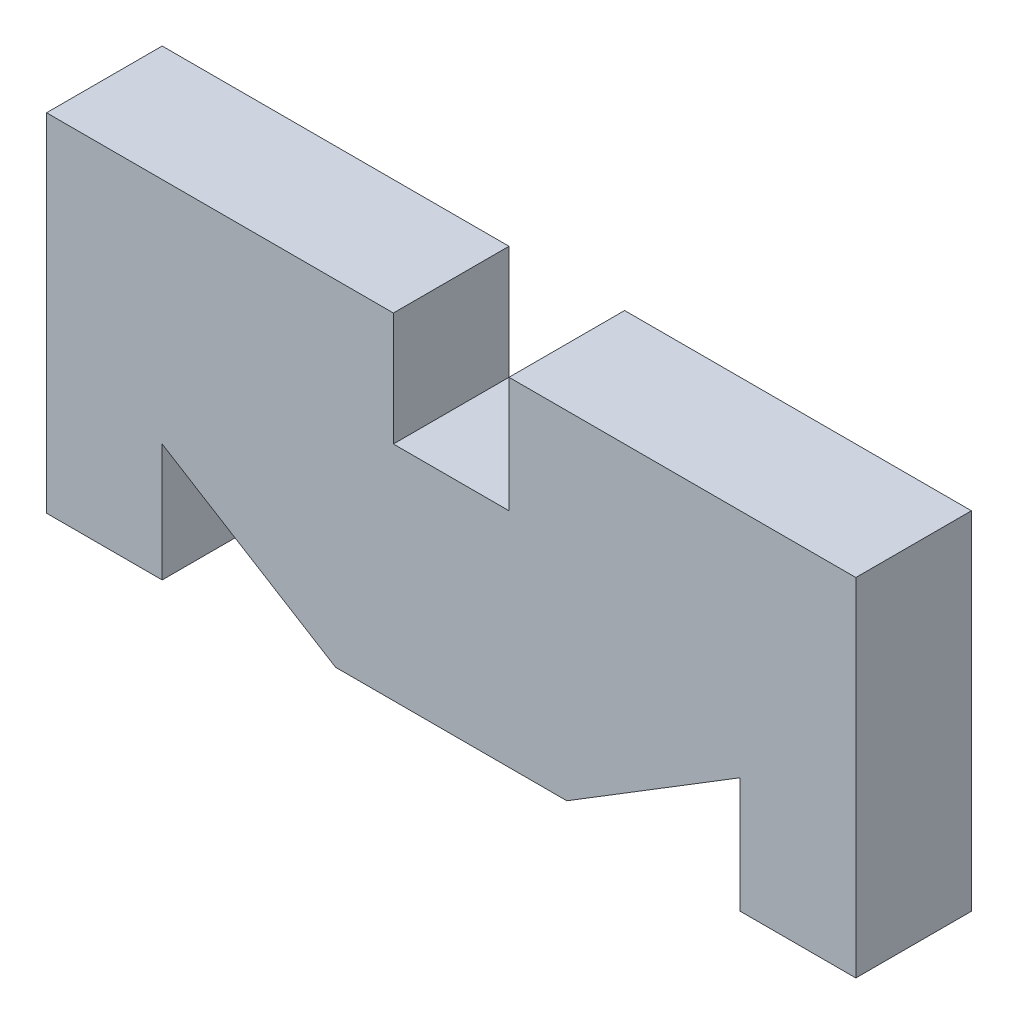
from build123d import *

# Parameters (mm, degrees)
BOSS_EXTRUDE1_DEPTH = 10


with BuildPart() as part:
    # Sketch2 → Boss-Extrude1 (new body)
    with BuildSketch(Plane.XY):
        Polygon((1.848454433, 23.718664804), (31.848454433, 23.718664804), (31.848454433, 13.90407856), (41.848454433, 13.90407856), (41.848454433, 23.90407856), (71.848454433, 23.90407856), (71.848454433, -6.09592144), (61.848454433, -6.09592144), (61.848454433, 3.90407856), (46.848454433, -5.321632509), (26.848454433, -5.321632509), (11.848454433, 3.90407856), (11.848454433, -6.281335196), (1.848454433, -6.281335196), align=None)
    extrude(amount=BOSS_EXTRUDE1_DEPTH)


solid = part.part
